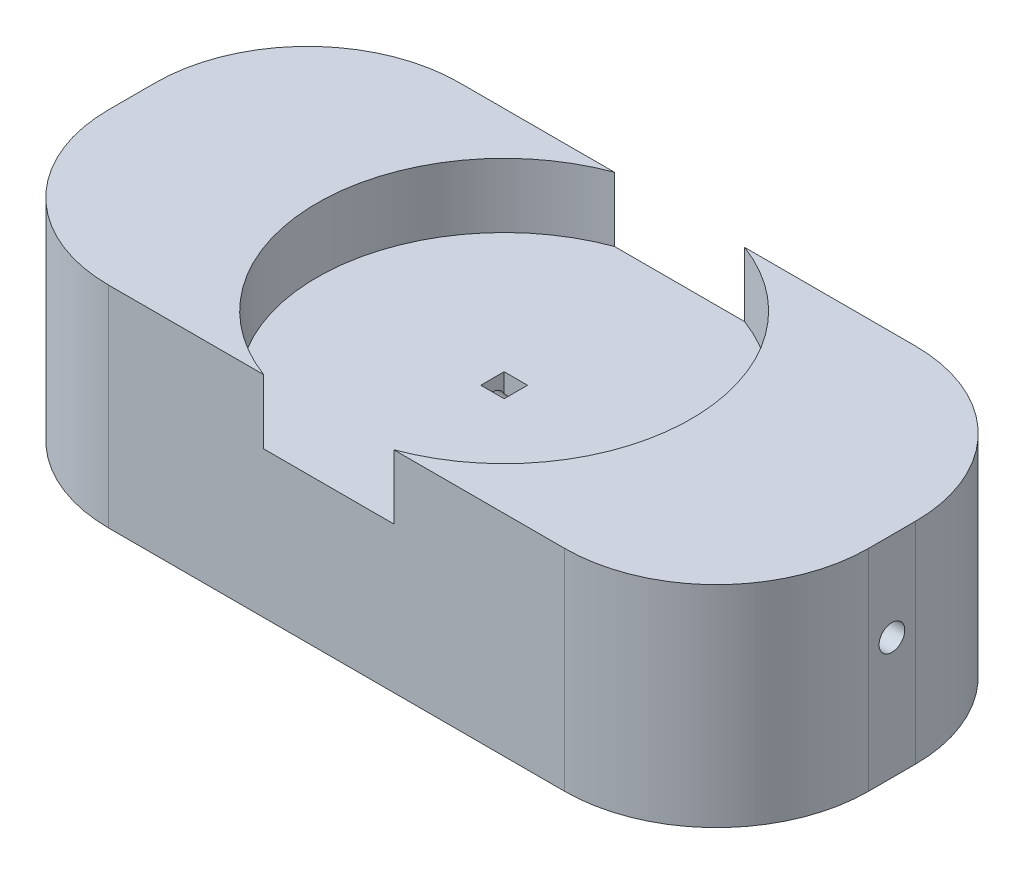
from build123d import *

# Parameters (mm, degrees)
SKETCH1_W           = 65
SKETCH1_H           = 30
BOSS_EXTRUDE1_DEPTH = 58
FILLET1_R           = 13
SKETCH15_W          = 83.696095513
SKETCH15_H          = 31.69844841
CUT_EXTRUDE7_DEPTH  = 50
SKETCH18_R          = 16
CUT_EXTRUDE10_DEPTH = 5.5
SKETCH3_R           = 1.1
CUT_EXTRUDE12_DEPTH = 89.396832522
SKETCH21_W          = 2
SKETCH21_H          = 2
CUT_EXTRUDE13_DEPTH = 8


with BuildPart() as part:
    # Sketch1 → Boss-Extrude1 (new body)
    with BuildSketch(Plane(origin=(0, 0, 0), x_dir=(1, 0, 0), z_dir=(0, 1, 0))):
        with Locations((7.5, 0)):
            Rectangle(SKETCH1_W, SKETCH1_H)
    extrude(amount=BOSS_EXTRUDE1_DEPTH)

    # Fillet1
    fillet1_edges = [part.edges().sort_by_distance(p)[0] for p in [
        (40, 29, 15),
        (-25, 29, 15),
        (-25, 29, -15),
        (40, 29, -15),
    ]]
    fillet(fillet1_edges, radius=FILLET1_R)

    # Sketch15 → Cut-Extrude7 (cut)
    with BuildSketch(Plane(origin=(0, -10, 0), x_dir=(-1, 0, 0), z_dir=(0, -1, 0))):
        with Locations((-0.057440767, 0.030479277)):
            Rectangle(SKETCH15_W, SKETCH15_H)
    extrude(amount=-CUT_EXTRUDE7_DEPTH, mode=Mode.SUBTRACT)

    # Sketch18 → Cut-Extrude10 (cut)
    with BuildSketch(Plane(origin=(0, 58, 0), x_dir=(1, 0, 0), z_dir=(0, 1, 0))):
        with Locations((6.828508286, 0)):
            Circle(SKETCH18_R)
    extrude(amount=-CUT_EXTRUDE10_DEPTH, mode=Mode.SUBTRACT)

    # Sketch3 → Cut-Extrude12 (cut, through all)
    with BuildSketch(Plane.ZY.offset(25)):
        with Locations((0, 50.4)):
            Circle(SKETCH3_R)
    extrude(amount=-CUT_EXTRUDE12_DEPTH, mode=Mode.SUBTRACT)

    # Sketch21 → Cut-Extrude13 (cut)
    with BuildSketch(Plane(origin=(0, 52.5, 0), x_dir=(1, 0, 0), z_dir=(0, 1, 0))):
        with Locations((6.828508286, 0)):
            Rectangle(SKETCH21_W, SKETCH21_H)
    extrude(amount=-CUT_EXTRUDE13_DEPTH, mode=Mode.SUBTRACT)


solid = part.part
